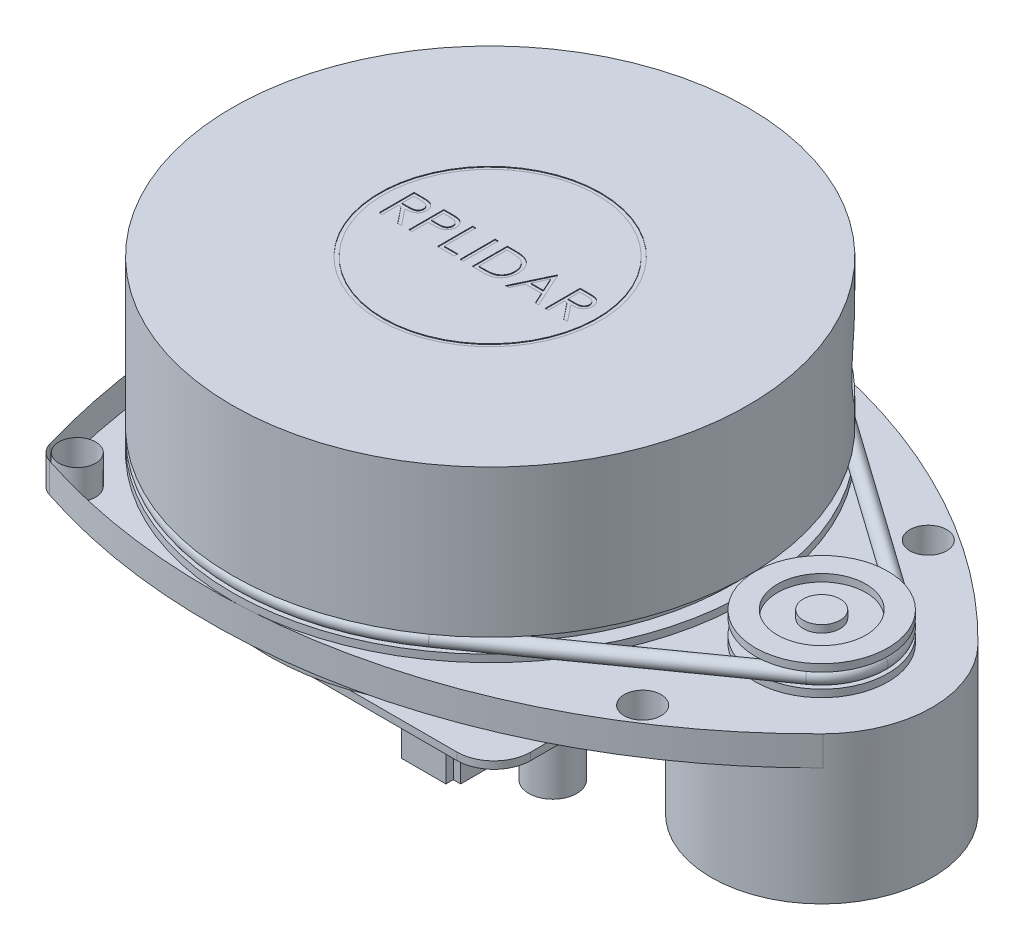
from build123d import *

# Parameters (mm, degrees)
SKETCH2_W            = 0.427403846
SKETCH2_H            = 4.7625
CUT_EXTRUDE2_DEPTH   = 0.1
SKETCH4_R            = 1
SKETCH11_R           = 9
BOSS_EXTRUDE2_DEPTH  = 1
SKETCH12_R           = 7
BOSS_EXTRUDE3_DEPTH  = 2
SKETCH13_R           = 9
BOSS_EXTRUDE4_DEPTH  = 1
SKETCH14_R           = 6
SKETCH14_R_2         = 2.5
CUT_EXTRUDE3_DEPTH   = 1
SKETCH15_R           = 4
CUT_EXTRUDE4_DEPTH   = 69.337398417
BOSS_EXTRUDE5_DEPTH  = 4
SKETCH18_R           = 15
BOSS_EXTRUDE7_DEPTH  = 16
BOSS_EXTRUDE11_DEPTH = 5
BOSS_EXTRUDE12_DEPTH = 1
FILLET1_R            = 3
SKETCH21_R           = 2.5
CUT_EXTRUDE6_DEPTH   = 10
SKETCH22_W           = 3.5
SKETCH22_H           = 8
SKETCH22_H_2         = 9
SKETCH22_H_3         = 10
BOSS_EXTRUDE13_DEPTH = 6.5
SKETCH23_R           = 3.25
BOSS_EXTRUDE14_DEPTH = 8
BOSS_EXTRUDE15_DEPTH = 4


with BuildPart() as part:
    # Sketch1 → Revolve2 (revolve)
    with BuildSketch(Plane.XY, mode=Mode.PRIVATE) as revolve2_sk:
        Polygon((0, 0), (-35, 0), (-35, 1), (-33, 1), (-33, 3), (-35, 3), (-35, 23), (-15, 23), (-15, 22.9), (-14.5, 22.9), (-14.5, 23), (0, 23), align=None)
    revolve(revolve2_sk.sketch.rotate(Axis((0, 67.529449104, 0), (0, -1, 0)), 270), axis=Axis((0, 67.529449104, 0), (0, -1, 0)))

    # Sketch2 → Cut-Extrude2 (cut)
    # profile 1 of 7: a face of its own
    with BuildSketch(Plane(origin=(0, 23, 0), x_dir=(1, 0, 0), z_dir=(0, 1, 0))):
        with BuildLine():
            Line((-12.694529907, 2.38125), (-11.741457491, 2.38125))
            add(Edge.make_bspline(
                [(-11.741457491, 2.38125), (-11.67785617, 2.381038292), (-11.555734588, 2.380631789), (-11.380783102, 2.378365162), (-11.221814802, 2.371868628), (-11.078912807, 2.366278019), (-10.952079737, 2.356083628), (-10.840926673, 2.346340033), (-10.745965556, 2.333585159), (-10.688481023, 2.321739565), (-10.662453585, 2.316376202)],
                knots=[0, 0, 0, 0, 1.410062039, 2.707475311, 3.878576406, 4.937260626, 5.877586885, 6.699081471, 7.410979367, 8, 8, 8, 8], degree=3))
            add(Edge.make_bspline(
                [(-10.662453585, 2.316376202), (-10.627610286, 2.307767282), (-10.558666989, 2.290733094), (-10.459402792, 2.254729137), (-10.364813659, 2.213064576), (-10.275292505, 2.164128228), (-10.191287732, 2.107556831), (-10.111933173, 2.044326993), (-10.036868739, 1.974784688), (-9.969130164, 1.897176565), (-9.905259526, 1.815756171), (-9.851390716, 1.727712845), (-9.804954328, 1.635644838), (-9.767983017, 1.538615816), (-9.738213346, 1.437566762), (-9.717222642, 1.331582364), (-9.704634418, 1.221145465), (-9.703352822, 1.145819168), (-9.702702984, 1.1076247)],
                knots=[0, 0, 0, 0, 1.027469482, 2.033020251, 3.019912614, 3.986113645, 4.951240523, 5.91722682, 6.890402269, 7.87763091, 8.8651537, 9.85103654, 10.82876324, 11.815024772, 12.821070561, 13.842952187, 14.906261191, 16, 16, 16, 16], degree=3))
            add(Edge.make_bspline(
                [(-9.702702984, 1.1076247), (-9.704701871, 1.044167646), (-9.708602217, 0.9203465), (-9.744967447, 0.740649372), (-9.804534783, 0.573023912), (-9.886617544, 0.41768118), (-9.991146902, 0.277649194), (-10.116774564, 0.154653611), (-10.263570614, 0.051729301), (-10.400226219, -0.01964398), (-10.520940898, -0.06535433), (-10.62031837, -0.097516662), (-10.728722364, -0.122365979), (-10.845114237, -0.144627444), (-10.969978354, -0.161434571), (-11.103015444, -0.173744401), (-11.244320386, -0.181437946), (-11.341392476, -0.182583674), (-11.391329787, -0.183173077)],
                knots=[0, 0, 0, 0, 1.260483769, 2.459530307, 3.627416485, 4.787058657, 5.939039949, 7.08810263, 8.267026773, 9.491475466, 10.141966685, 10.831826277, 11.566392101, 12.351337768, 13.187381173, 14.07005841, 15.007169909, 16, 16, 16, 16], degree=3))
            Line((-11.391329787, -0.183173077), (-9.641645292, -2.38125))
            Line((-9.641645292, -2.38125), (-10.170175941, -2.38125))
            Line((-10.170175941, -2.38125), (-11.919860436, -0.183173077))
            Line((-11.919860436, -0.183173077), (-12.267126061, -0.183173077))
            Line((-12.267126061, -0.183173077), (-12.267126061, -2.38125))
            Line((-12.267126061, -2.38125), (-12.694529907, -2.38125))
            Line((-12.694529907, -2.38125), (-12.694529907, 2.38125))
        make_face()
        with BuildLine():
            Line((-12.267126061, 1.892788462), (-12.267126061, 0.305288462))
            Line((-12.267126061, 0.305288462), (-11.395145893, 0.298610276))
            add(Edge.make_bspline(
                [(-11.395145893, 0.298610276), (-11.354433268, 0.298592265), (-11.275520607, 0.298557354), (-11.161355774, 0.303991742), (-11.055056622, 0.310173901), (-10.957029741, 0.319629974), (-10.86723134, 0.331816629), (-10.785706303, 0.34706069), (-10.71232155, 0.364820818), (-10.62673461, 0.392309459), (-10.531162759, 0.435860505), (-10.427297451, 0.499222844), (-10.338847841, 0.578918681), (-10.264120322, 0.67005042), (-10.204072774, 0.770248316), (-10.161738157, 0.878311304), (-10.134874334, 0.991511299), (-10.131705849, 1.069314368), (-10.13010683, 1.108578726)],
                knots=[0, 0, 0, 0, 1.146690395, 2.22261258, 3.21895312, 4.145990853, 4.996080663, 5.770904154, 6.481378293, 7.121626537, 8.300444488, 9.431385265, 10.535395872, 11.636531494, 12.74115979, 13.810798291, 14.895190096, 16, 16, 16, 16], degree=3))
            add(Edge.make_bspline(
                [(-10.13010683, 1.108578726), (-10.131742574, 1.146878171), (-10.13498402, 1.222773696), (-10.161448237, 1.333884059), (-10.206201288, 1.438750159), (-10.266511191, 1.536945405), (-10.339988612, 1.626079996), (-10.426146064, 1.702344157), (-10.522627776, 1.765276465), (-10.612803943, 1.805491532), (-10.693404782, 1.830147476), (-10.763385855, 1.847498166), (-10.842458973, 1.861437962), (-10.931008079, 1.872606787), (-11.028655155, 1.882206551), (-11.135893934, 1.888672364), (-11.25201291, 1.892501229), (-11.332494984, 1.892690489), (-11.374157311, 1.892788462)],
                knots=[0, 0, 0, 0, 1.101028733, 2.181837193, 3.264309656, 4.369019818, 5.486613113, 6.575447106, 7.666700264, 8.788928104, 9.402425223, 10.0903467, 10.862060571, 11.710948788, 12.657782767, 13.684531032, 14.801375019, 16, 16, 16, 16], degree=3))
            Line((-11.374157311, 1.892788462), (-12.267126061, 1.892788462))
        make_face(mode=Mode.SUBTRACT)
    # profile 2 of 7: a face of its own
    with BuildSketch(Plane(origin=(0, 23, 0), x_dir=(1, 0, 0), z_dir=(0, 1, 0))):
        with BuildLine():
            Line((-8.664722215, 2.38125), (-7.730730328, 2.38125))
            add(Edge.make_bspline(
                [(-7.730730328, 2.38125), (-7.666489773, 2.381179384), (-7.543402018, 2.381044081), (-7.366896889, 2.376941873), (-7.206591504, 2.371462696), (-7.062831521, 2.363867334), (-6.935174617, 2.354891259), (-6.824198434, 2.342301877), (-6.72903068, 2.329156975), (-6.672007976, 2.315792847), (-6.646002263, 2.309698017)],
                knots=[0, 0, 0, 0, 1.415646017, 2.712440637, 3.8905458, 4.950247383, 5.884950622, 6.709939814, 7.411656543, 8, 8, 8, 8], degree=3))
            add(Edge.make_bspline(
                [(-6.646002263, 2.309698017), (-6.613081776, 2.300687435), (-6.548016532, 2.282878595), (-6.454261898, 2.247209207), (-6.365061844, 2.204915261), (-6.280110331, 2.156713399), (-6.200451282, 2.100535543), (-6.124896205, 2.038658941), (-6.054111875, 1.969654985), (-5.988496338, 1.894297622), (-5.928237381, 1.813851907), (-5.876353777, 1.727116945), (-5.832909943, 1.635552707), (-5.795649134, 1.539222883), (-5.768831559, 1.43731855), (-5.74862917, 1.330547774), (-5.735806306, 1.218921999), (-5.734578177, 1.142640536), (-5.733952984, 1.103808594)],
                knots=[0, 0, 0, 0, 0.999701418, 1.975846123, 2.934577507, 3.890451536, 4.834027766, 5.787354733, 6.749476667, 7.726910423, 8.712836071, 9.690891519, 10.682875813, 11.679750201, 12.712814741, 13.765529915, 14.8625177, 16, 16, 16, 16], degree=3))
            add(Edge.make_bspline(
                [(-5.733952984, 1.103808594), (-5.734526423, 1.064650262), (-5.735648394, 0.98803434), (-5.749114411, 0.875948511), (-5.767252993, 0.768835273), (-5.795143625, 0.666932128), (-5.831672916, 0.57084424), (-5.874524602, 0.479103206), (-5.926209335, 0.393269796), (-5.985597478, 0.313032397), (-6.051662326, 0.238315694), (-6.12412436, 0.169661135), (-6.20269104, 0.107470589), (-6.287112677, 0.051604635), (-6.378212293, 0.003358769), (-6.474608223, -0.039853849), (-6.577138339, -0.076145543), (-6.648089403, -0.095236448), (-6.684163321, -0.104942909)],
                knots=[0, 0, 0, 0, 1.121902311, 2.195077645, 3.232258892, 4.234102512, 5.217864754, 6.176164875, 7.132989551, 8.084763148, 9.034132444, 9.988522005, 10.94243251, 11.903244335, 12.886203696, 13.894208494, 14.929344452, 16, 16, 16, 16], degree=3))
            add(Edge.make_bspline(
                [(-6.684163321, -0.104942909), (-6.714000157, -0.111287894), (-6.77938932, -0.125193297), (-6.887079952, -0.140716947), (-7.012463495, -0.15396704), (-7.155368812, -0.163901802), (-7.315667629, -0.172406768), (-7.493446661, -0.179166924), (-7.689054888, -0.182881475), (-7.825495402, -0.183073054), (-7.896730929, -0.183173077)],
                knots=[0, 0, 0, 0, 0.601384939, 1.31797006, 2.144135048, 3.087295005, 4.142315834, 5.309527816, 6.595305764, 8, 8, 8, 8], degree=3))
            Line((-7.896730929, -0.183173077), (-8.237318369, -0.183173077))
            Line((-8.237318369, -0.183173077), (-8.237318369, -2.38125))
            Line((-8.237318369, -2.38125), (-8.664722215, -2.38125))
            Line((-8.664722215, -2.38125), (-8.664722215, 2.38125))
        make_face()
        with BuildLine():
            Line((-8.237318369, 1.892788462), (-8.237318369, 0.305288462))
            Line((-8.237318369, 0.305288462), (-7.403499258, 0.294794171))
            add(Edge.make_bspline(
                [(-7.403499258, 0.294794171), (-7.362786788, 0.294773129), (-7.284192203, 0.294732509), (-7.170659342, 0.300155259), (-7.065327419, 0.30641527), (-6.968519979, 0.315580937), (-6.880193382, 0.328536648), (-6.800200352, 0.341615477), (-6.729161156, 0.360536703), (-6.646022599, 0.386013451), (-6.553380616, 0.429464617), (-6.452595845, 0.492533574), (-6.367183011, 0.572925538), (-6.293271329, 0.663314837), (-6.234616545, 0.763870438), (-6.191677855, 0.87146067), (-6.166448637, 0.984982137), (-6.163065638, 1.062662783), (-6.16135683, 1.101900541)],
                knots=[0, 0, 0, 0, 1.160613943, 2.240541288, 3.23993089, 4.169200891, 5.011653406, 5.7853311, 6.478053781, 7.106038997, 8.262395093, 9.384106736, 10.481365981, 11.59014053, 12.70357646, 13.786202915, 14.881775077, 16, 16, 16, 16], degree=3))
            add(Edge.make_bspline(
                [(-6.16135683, 1.101900541), (-6.163074931, 1.140189018), (-6.166490304, 1.216301772), (-6.191875603, 1.327851443), (-6.234533063, 1.434307883), (-6.293665072, 1.533603403), (-6.36543068, 1.623667454), (-6.448841572, 1.701904616), (-6.543701403, 1.764799148), (-6.631941317, 1.80539372), (-6.710320074, 1.830179506), (-6.778399277, 1.847521592), (-6.855266944, 1.861367685), (-6.940948101, 1.872579294), (-7.03477865, 1.882177039), (-7.137564715, 1.888689387), (-7.248916922, 1.892501369), (-7.326219877, 1.892690447), (-7.366292227, 1.892788462)],
                knots=[0, 0, 0, 0, 1.120700087, 2.227813068, 3.331159281, 4.466773991, 5.599788987, 6.693661531, 7.80175334, 8.91857717, 9.525282508, 10.207424825, 10.974604443, 11.810962634, 12.737642355, 13.736264703, 14.826523623, 16, 16, 16, 16], degree=3))
            Line((-7.366292227, 1.892788462), (-8.237318369, 1.892788462))
        make_face(mode=Mode.SUBTRACT)
    # profile 3 of 7: a face of its own
    with BuildSketch(Plane(origin=(0, 23, 0), x_dir=(1, 0, 0), z_dir=(0, 1, 0))):
        Polygon((-4.757029907, 2.38125), (-4.329626061, 2.38125), (-4.329626061, -1.892788462), (-2.497895292, -1.892788462), (-2.497895292, -2.38125), (-4.757029907, -2.38125), align=None)
    # profile 4 of 7: a face of its own
    with BuildSketch(Plane(origin=(0, 23, 0), x_dir=(1, 0, 0), z_dir=(0, 1, 0))):
        with Locations((-1.490443369, 0)):
            Rectangle(SKETCH2_W, SKETCH2_H)
    # profile 5 of 7: a face of its own
    with BuildSketch(Plane(origin=(0, 23, 0), x_dir=(1, 0, 0), z_dir=(0, 1, 0))):
        with BuildLine():
            Line((-0.0555876, -2.38125), (-0.0555876, 2.38125))
            Line((-0.0555876, 2.38125), (0.906071054, 2.38125))
            add(Edge.make_bspline(
                [(0.906071054, 2.38125), (0.989712785, 2.380647789), (1.151308173, 2.37948432), (1.384823681, 2.372107355), (1.600883015, 2.359057471), (1.798775584, 2.340048938), (1.979044662, 2.31670856), (2.141185482, 2.287452652), (2.286036434, 2.252906606), (2.375121637, 2.223453333), (2.417248939, 2.20952524)],
                knots=[0, 0, 0, 0, 1.314313732, 2.53924729, 3.670748893, 4.714932338, 5.66265055, 6.526160246, 7.303039223, 8, 8, 8, 8], degree=3))
            add(Edge.make_bspline(
                [(2.417248939, 2.20952524), (2.472350709, 2.188528459), (2.581304724, 2.147011033), (2.736435845, 2.068693351), (2.882474999, 1.979956952), (3.020205336, 1.880684868), (3.146480746, 1.768066236), (3.266234348, 1.646884988), (3.37456724, 1.512734425), (3.4737746, 1.368396673), (3.563222051, 1.215572059), (3.64097212, 1.054551786), (3.705543446, 0.886153585), (3.759146372, 0.710845759), (3.801391731, 0.528242831), (3.830214288, 0.338132177), (3.849224813, 0.141265137), (3.851135326, 0.007677742), (3.852104708, -0.060103666)],
                knots=[0, 0, 0, 0, 0.984719456, 1.947108742, 2.898477687, 3.838006223, 4.779231079, 5.722358779, 6.681677486, 7.655904652, 8.64651281, 9.637519902, 10.640069247, 11.656948941, 12.698408672, 13.768548281, 14.867775369, 16, 16, 16, 16], degree=3))
            add(Edge.make_bspline(
                [(3.852104708, -0.060103666), (3.851248863, -0.118969851), (3.849562331, -0.234971817), (3.834418512, -0.405933179), (3.812407162, -0.571822717), (3.778329164, -0.731850473), (3.73696003, -0.887418513), (3.683940953, -1.036868817), (3.623204796, -1.181572357), (3.552379782, -1.319572565), (3.474626683, -1.450314583), (3.391185311, -1.573561998), (3.302144665, -1.687556139), (3.206655679, -1.792642215), (3.105952322, -1.888661805), (2.999375286, -1.976417012), (2.886649564, -2.054190752), (2.768280044, -2.12503921), (2.640813597, -2.186843337), (2.501835865, -2.2391356), (2.350754155, -2.282469745), (2.187939306, -2.318625142), (2.013110003, -2.347305329), (1.826094839, -2.366527313), (1.627181148, -2.379526125), (1.490593648, -2.380664218), (1.420291307, -2.38125)],
                knots=[0, 0, 0, 0, 1.105936401, 2.179363191, 3.223086493, 4.248585256, 5.251745608, 6.245858792, 7.225916811, 8.198733463, 9.158002045, 10.082870192, 10.993790845, 11.873723703, 12.748670949, 13.606408763, 14.465103618, 15.319838547, 16.196477973, 17.123216899, 18.106603292, 19.147568657, 20.255746949, 21.433717677, 22.679120308, 24, 24, 24, 24], degree=3))
            Line((1.420291307, -2.38125), (-0.0555876, -2.38125))
        make_face()
        with BuildLine():
            Line((0.371816247, -1.892788462), (0.918473398, -1.892788462))
            add(Edge.make_bspline(
                [(0.918473398, -1.892788462), (0.997025217, -1.892450873), (1.148109132, -1.891801567), (1.36535805, -1.88610398), (1.563858228, -1.876794058), (1.743637854, -1.863765113), (1.904595419, -1.846526747), (2.047067307, -1.82730679), (2.170586498, -1.803361688), (2.245329767, -1.781656989), (2.279869131, -1.771627103)],
                knots=[0, 0, 0, 0, 1.375205317, 2.645023457, 3.804390687, 4.853969522, 5.800190428, 6.637939096, 7.370582563, 8, 8, 8, 8], degree=3))
            add(Edge.make_bspline(
                [(2.279869131, -1.771627103), (2.323341724, -1.756316947), (2.409248567, -1.726062318), (2.532911758, -1.670874929), (2.648241825, -1.605503398), (2.757248681, -1.532838161), (2.858386023, -1.45031628), (2.95285241, -1.359732185), (3.040457647, -1.260624866), (3.120296616, -1.153117331), (3.191745415, -1.037878717), (3.253618767, -0.916041947), (3.307845315, -0.788941966), (3.350406543, -0.654627003), (3.383765248, -0.51429782), (3.407393627, -0.367944544), (3.422109377, -0.215594507), (3.423825848, -0.111973224), (3.424700862, -0.059149639)],
                knots=[0, 0, 0, 0, 0.998632004, 1.973411704, 2.929992603, 3.868527914, 4.809262121, 5.754881198, 6.702106254, 7.672490631, 8.653608572, 9.636854334, 10.631411391, 11.644891563, 12.686317036, 13.754757253, 14.855430412, 16, 16, 16, 16], degree=3))
            add(Edge.make_bspline(
                [(3.424700862, -0.059149639), (3.424002425, -0.003450868), (3.422630338, 0.105969861), (3.405384223, 0.266521486), (3.380181678, 0.420936228), (3.343736733, 0.569224416), (3.297294359, 0.711675352), (3.239335221, 0.847501186), (3.173113857, 0.978136382), (3.09432396, 1.100565787), (3.008033456, 1.216353196), (2.91226927, 1.322427563), (2.808552853, 1.419030522), (2.698015433, 1.507666515), (2.577541737, 1.584769589), (2.449969751, 1.65373968), (2.313427963, 1.712272017), (2.21843283, 1.743403613), (2.17015609, 1.75922476)],
                knots=[0, 0, 0, 0, 1.122418816, 2.205001699, 3.251619955, 4.274784885, 5.280384055, 6.268708349, 7.249350384, 8.229342522, 9.199999885, 10.157847722, 11.105861043, 12.055065948, 13.010012805, 13.98527497, 14.976112212, 16, 16, 16, 16], degree=3))
            add(Edge.make_bspline(
                [(2.17015609, 1.75922476), (2.130217566, 1.770268899), (2.045297306, 1.793751769), (1.906722892, 1.819367723), (1.750764421, 1.841961702), (1.576729471, 1.861090677), (1.384816425, 1.874816639), (1.174877685, 1.885119035), (0.946822509, 1.892067703), (0.788731275, 1.892542194), (0.706679528, 1.892788462)],
                knots=[0, 0, 0, 0, 0.674548936, 1.434276114, 2.292660221, 3.240891867, 4.284742987, 5.42552168, 6.663806718, 8, 8, 8, 8], degree=3))
            Line((0.706679528, 1.892788462), (0.371816247, 1.892788462))
            Line((0.371816247, 1.892788462), (0.371816247, -1.892788462))
        make_face(mode=Mode.SUBTRACT)
    # profile 6 of 7: a face of its own
    with BuildSketch(Plane(origin=(0, 23, 0), x_dir=(1, 0, 0), z_dir=(0, 1, 0))):
        Polygon((6.782873939, 2.38125), (8.980950862, -2.38125), (8.516339985, -2.38125), (7.81226847, -0.854807692), (5.653306631, -0.854807692), (4.930154588, -2.38125), (4.462681631, -2.38125), (6.721816247, 2.38125), align=None)
        Polygon((6.747574961, 1.452028245), (5.886089083, -0.366346154), (7.58711823, -0.366346154), align=None, mode=Mode.SUBTRACT)
    # profile 7 of 7: a face of its own
    with BuildSketch(Plane(origin=(0, 23, 0), x_dir=(1, 0, 0), z_dir=(0, 1, 0))):
        with BuildLine():
            Line((9.835758554, 2.38125), (10.78883097, 2.38125))
            add(Edge.make_bspline(
                [(10.78883097, 2.38125), (10.852432291, 2.381038292), (10.974553874, 2.380631789), (11.149505359, 2.378365162), (11.308473659, 2.371868628), (11.451375655, 2.366278019), (11.578208725, 2.356083628), (11.689361788, 2.346340033), (11.784322905, 2.333585159), (11.841807439, 2.321739565), (11.867834876, 2.316376202)],
                knots=[0, 0, 0, 0, 1.410062039, 2.707475311, 3.878576406, 4.937260626, 5.877586885, 6.699081471, 7.410979367, 8, 8, 8, 8], degree=3))
            add(Edge.make_bspline(
                [(11.867834876, 2.316376202), (11.902678176, 2.307767282), (11.971621472, 2.290733094), (12.070885669, 2.254729137), (12.165474803, 2.213064576), (12.254995957, 2.164128228), (12.33900073, 2.107556831), (12.418355288, 2.044326993), (12.493419722, 1.974784688), (12.561158298, 1.897176565), (12.625028936, 1.815756171), (12.678897745, 1.727712845), (12.725334134, 1.635644838), (12.762305445, 1.538615816), (12.792075116, 1.437566762), (12.81306582, 1.331582364), (12.825654043, 1.221145465), (12.826935639, 1.145819168), (12.827585477, 1.1076247)],
                knots=[0, 0, 0, 0, 1.027469482, 2.033020251, 3.019912614, 3.986113645, 4.951240523, 5.91722682, 6.890402269, 7.87763091, 8.8651537, 9.85103654, 10.82876324, 11.815024772, 12.821070561, 13.842952187, 14.906261191, 16, 16, 16, 16], degree=3))
            add(Edge.make_bspline(
                [(12.827585477, 1.1076247), (12.825586591, 1.044167646), (12.821686245, 0.9203465), (12.785321015, 0.740649372), (12.725753679, 0.573023912), (12.643670918, 0.41768118), (12.53914156, 0.277649194), (12.413513898, 0.154653611), (12.266717848, 0.051729301), (12.130062243, -0.01964398), (12.009347564, -0.06535433), (11.909970092, -0.097516662), (11.801566097, -0.122365979), (11.685174224, -0.144627444), (11.560310107, -0.161434571), (11.427273018, -0.173744401), (11.285968076, -0.181437946), (11.188895985, -0.182583674), (11.138958675, -0.183173077)],
                knots=[0, 0, 0, 0, 1.260483769, 2.459530307, 3.627416485, 4.787058657, 5.939039949, 7.08810263, 8.267026773, 9.491475466, 10.141966685, 10.831826277, 11.566392101, 12.351337768, 13.187381173, 14.07005841, 15.007169909, 16, 16, 16, 16], degree=3))
            Line((11.138958675, -0.183173077), (12.88864317, -2.38125))
            Line((12.88864317, -2.38125), (12.360112521, -2.38125))
            Line((12.360112521, -2.38125), (10.610428025, -0.183173077))
            Line((10.610428025, -0.183173077), (10.2631624, -0.183173077))
            Line((10.2631624, -0.183173077), (10.2631624, -2.38125))
            Line((10.2631624, -2.38125), (9.835758554, -2.38125))
            Line((9.835758554, -2.38125), (9.835758554, 2.38125))
        make_face()
        with BuildLine():
            Line((10.2631624, 1.892788462), (10.2631624, 0.305288462))
            Line((10.2631624, 0.305288462), (11.135142569, 0.298610276))
            add(Edge.make_bspline(
                [(11.135142569, 0.298610276), (11.175855193, 0.298592265), (11.254767855, 0.298557354), (11.368932688, 0.303991742), (11.47523184, 0.310173901), (11.573258721, 0.319629974), (11.663057121, 0.331816629), (11.744582159, 0.34706069), (11.817966911, 0.364820818), (11.903553851, 0.392309459), (11.999125703, 0.435860505), (12.102991011, 0.499222844), (12.19144062, 0.578918681), (12.26616814, 0.67005042), (12.326215688, 0.770248316), (12.368550305, 0.878311304), (12.395414128, 0.991511299), (12.398582613, 1.069314368), (12.400181631, 1.108578726)],
                knots=[0, 0, 0, 0, 1.146690395, 2.22261258, 3.21895312, 4.145990853, 4.996080663, 5.770904154, 6.481378293, 7.121626537, 8.300444488, 9.431385265, 10.535395872, 11.636531494, 12.74115979, 13.810798291, 14.895190096, 16, 16, 16, 16], degree=3))
            add(Edge.make_bspline(
                [(12.400181631, 1.108578726), (12.398545888, 1.146878171), (12.395304441, 1.222773696), (12.368840224, 1.333884059), (12.324087173, 1.438750159), (12.263777271, 1.536945405), (12.190299849, 1.626079996), (12.104142397, 1.702344157), (12.007660685, 1.765276465), (11.917484519, 1.805491532), (11.83688368, 1.830147476), (11.766902607, 1.847498166), (11.687829489, 1.861437962), (11.599280382, 1.872606787), (11.501633306, 1.882206551), (11.394394527, 1.888672364), (11.278275551, 1.892501229), (11.197793477, 1.892690489), (11.15613115, 1.892788462)],
                knots=[0, 0, 0, 0, 1.101028733, 2.181837193, 3.264309656, 4.369019818, 5.486613113, 6.575447106, 7.666700264, 8.788928104, 9.402425223, 10.0903467, 10.862060571, 11.710948788, 12.657782767, 13.684531032, 14.801375019, 16, 16, 16, 16], degree=3))
            Line((11.15613115, 1.892788462), (10.2631624, 1.892788462))
        make_face(mode=Mode.SUBTRACT)
    extrude(amount=-CUT_EXTRUDE2_DEPTH, mode=Mode.SUBTRACT)

    # Sketch15 → Cut-Extrude4 (cut, through all)
    with BuildSketch(Plane.XY):
        with Locations((-20, 12)):
            Circle(SKETCH15_R)
        with BuildLine():
            Line((13, 17), (26, 17))
            ThreePointArc((26, 17), (27.700609733, 12), (26, 7))
            Line((26, 7), (13, 7))
            ThreePointArc((13, 7), (11.299390267, 12), (13, 17))
        make_face()
    extrude(amount=-CUT_EXTRUDE4_DEPTH, mode=Mode.SUBTRACT)



with BuildPart() as body_2:
    # Sweep1: sweep along a path in Sketch3
    with BuildLine(Plane(origin=(0, 1, 0), x_dir=(1, 0, 0), z_dir=(0, 1, 0))) as sweep1_path:
        Line((20.222222222, 28.566794157), (50.2, 7.345747069))
        ThreePointArc((50.2, 7.345747069), (54, 0), (50.2, -7.345747069))
        Line((50.2, -7.345747069), (20.222222222, -28.566794157))
        ThreePointArc((20.222222222, -28.566794157), (-35, 0), (20.222222222, 28.566794157))
    # Sketch4 → Sweep1 (sweep)
    with BuildSketch(Plane.XY):
        with Locations((53, 2)):
            Circle(SKETCH4_R)
    sweep(path=sweep1_path.line)


with BuildPart() as body_3:
    # Sketch11 → Boss-Extrude2 (new body)
    with BuildSketch(Plane(origin=(0, 0, 0), x_dir=(1, 0, 0), z_dir=(0, 1, 0))):
        with Locations(Location((45, 0, 0), (0, 0, 270))):
            Circle(SKETCH11_R)
    extrude(amount=BOSS_EXTRUDE2_DEPTH)

    # Sketch12 → Boss-Extrude3 (add)
    with BuildSketch(Plane(origin=(0, 1, 0), x_dir=(1, 0, 0), z_dir=(0, 1, 0))):
        with Locations(Location((45, 0, 0), (0, 0, 270))):
            Circle(SKETCH12_R)
    extrude(amount=BOSS_EXTRUDE3_DEPTH)

    # Sketch13 → Boss-Extrude4 (add)
    with BuildSketch(Plane(origin=(0, 3, 0), x_dir=(1, 0, 0), z_dir=(0, 1, 0))):
        with Locations(Location((45, 0, 0), (0, 0, 270))):
            Circle(SKETCH13_R)
    extrude(amount=BOSS_EXTRUDE4_DEPTH)

    # Sketch14 → Cut-Extrude3 (cut)
    with BuildSketch(Plane(origin=(0, 4, 0), x_dir=(1, 0, 0), z_dir=(0, 1, 0))):
        with Locations(Location((45, 0, 0), (0, 0, 270))):
            Circle(SKETCH14_R)
        with Locations(Location((45, 0, 0), (0, 0, 270))):
            Circle(SKETCH14_R_2, mode=Mode.SUBTRACT)
    extrude(amount=-CUT_EXTRUDE3_DEPTH, mode=Mode.SUBTRACT)


with BuildPart() as part_1:
    add(part.part)

    add(body_3.part)  # Boss-Extrude5 merges body 3
    # Sketch16 → Boss-Extrude5 (add)
    with BuildSketch(Plane.XZ):
        with BuildLine():
            ThreePointArc((55.685724052, -10.5268847), (60, 0), (55.685724052, 10.5268847))
            ThreePointArc((55.685724052, 10.5268847), (15.53026924, 32.983218297), (-30.405591591, 30.405591591))
            ThreePointArc((-30.405591591, 30.405591591), (-35, 0), (-30.405591591, -30.405591591))
            ThreePointArc((-30.405591591, -30.405591591), (15.53026924, -32.983218297), (55.685724052, -10.5268847))
        make_face()
    extrude(amount=BOSS_EXTRUDE5_DEPTH)

    # Sketch18 → Boss-Extrude7 (add)
    with BuildSketch(Plane.XZ.offset(4)):
        with Locations(Location((45, 0, 0), (0, 0, 44.570979011))):
            Circle(SKETCH18_R)
    extrude(amount=BOSS_EXTRUDE7_DEPTH)

    # Sketch19 → Boss-Extrude11 (add)
    with BuildSketch(Plane.XZ.offset(4)):
        with BuildLine():
            ThreePointArc((29.830555556, 3.184015585), (-30, 0), (29.830555556, -3.184015585))
            ThreePointArc((29.830555556, -3.184015585), (29.5, 0), (29.830555556, 3.184015585))
        make_face()
    extrude(amount=BOSS_EXTRUDE11_DEPTH)

    # Sketch20 → Boss-Extrude12 (add)
    with BuildSketch(Plane.XZ.offset(9)):
        with BuildLine():
            Line((29, 23.5), (29, -23.5))
            ThreePointArc((29, -23.5), (27.535533906, -27.035533906), (24, -28.5))
            Line((24, -28.5), (-12, -28.5))
            ThreePointArc((-12, -28.5), (-15.535533906, -27.035533906), (-17, -23.5))
            Line((-17, -23.5), (-17, 23.5))
            ThreePointArc((-17, 23.5), (-15.535533906, 27.035533906), (-12, 28.5))
            Line((-12, 28.5), (24, 28.5))
            ThreePointArc((24, 28.5), (27.535533906, 27.035533906), (29, 23.5))
        make_face()
    extrude(amount=BOSS_EXTRUDE12_DEPTH)

    # Fillet1
    fillet1_edges = [part_1.edges().sort_by_distance(p)[0] for p in [
        (-30.405591591, -2, 30.405591591),
        (-30.405591591, -2, -30.405591591),
    ]]
    fillet(fillet1_edges, radius=FILLET1_R)

    # Sketch21 → Cut-Extrude6 (cut)
    with BuildSketch(Plane(origin=(0, 0, 0), x_dir=(1, 0, 0), z_dir=(0, 1, 0))):
        with Locations(Location((-27.976986072, 28.065691027, 0), (0, 0, 270))):
            Circle(SKETCH21_R)
        with Locations(Location((40.081040833, 19.385660698, 0), (0, 0, 270))):
            Circle(SKETCH21_R)
        with Locations(Location((-27.976986072, -28.065691027, 0), (0, 0, 90))):
            Circle(SKETCH21_R)
        with Locations(Location((40.081040833, -19.385660698, 0), (0, 0, 90))):
            Circle(SKETCH21_R)
    extrude(amount=-CUT_EXTRUDE6_DEPTH, mode=Mode.SUBTRACT)

    # Sketch22 → Boss-Extrude13 (add)
    with BuildSketch(Plane.XZ.offset(10)):
        with Locations((24.75, -18.5)):
            Rectangle(SKETCH22_W, SKETCH22_H)
        with Locations((24.75, -8)):
            Rectangle(SKETCH22_W, SKETCH22_H_2)
        with Locations((24.75, 3.5)):
            Rectangle(SKETCH22_W, SKETCH22_H_3)
    extrude(amount=BOSS_EXTRUDE13_DEPTH)

    # Sketch23 → Boss-Extrude14 (add)
    with BuildSketch(Plane.XZ.offset(10)):
        with Locations(Location((24.75, 16.25, 0), (0, 0, 270))):
            Circle(SKETCH23_R)
    extrude(amount=BOSS_EXTRUDE14_DEPTH)

    # Sketch24 → Boss-Extrude15 (add)
    with BuildSketch(Plane.XZ.offset(10)):
        Polygon((16, 27), (16, 28), (22, 28), (22, 27), (23, 27), (23, 21), (22, 21), (22, 20), (16, 20), (16, 21), (15, 21), (15, 27), align=None)
    extrude(amount=BOSS_EXTRUDE15_DEPTH)


solid = Compound([body_2.part, part_1.part])
